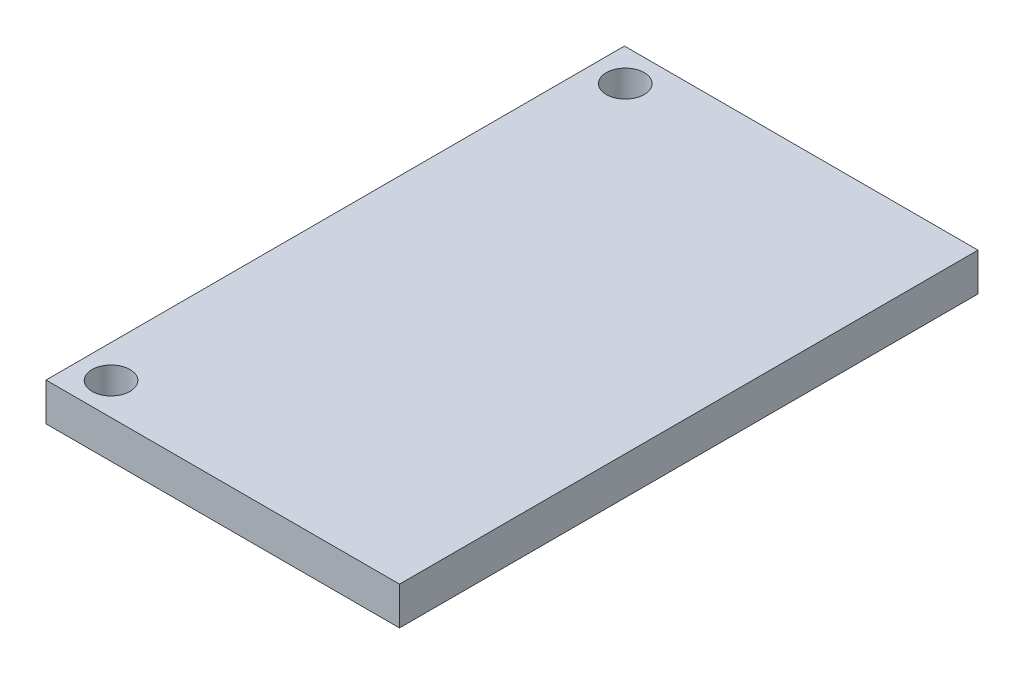
from build123d import *

# Parameters (mm, degrees)
CROQUIS2_W              = 27.94
CROQUIS2_H              = 45.72
SALIENTE_EXTRUIR2_DEPTH = 3
CROQUIS3_R              = 1.5
CORTAR_EXTRUIR1_DEPTH   = 54.665277415


with BuildPart() as part:
    # Croquis2 → Saliente-Extruir2 (new body)
    with BuildSketch(Plane(origin=(0, 0, 0), x_dir=(1, 0, 0), z_dir=(0, 1, 0))):
        with Locations((13.97, -22.86)):
            Rectangle(CROQUIS2_W, CROQUIS2_H)
    extrude(amount=SALIENTE_EXTRUIR2_DEPTH)

    # Croquis3 → Cortar-Extruir1 (cut, through all)
    with BuildSketch(Plane(origin=(0, 3, 0), x_dir=(1, 0, 0), z_dir=(0, 1, 0))):
        with Locations(Location((2.6, -2.54, 0), (0, 0, 270))):
            Circle(CROQUIS3_R)
        with Locations(Location((2.6, -43.18, 0), (0, 0, 270))):
            Circle(CROQUIS3_R)
    extrude(amount=-CORTAR_EXTRUIR1_DEPTH, mode=Mode.SUBTRACT)


solid = part.part
